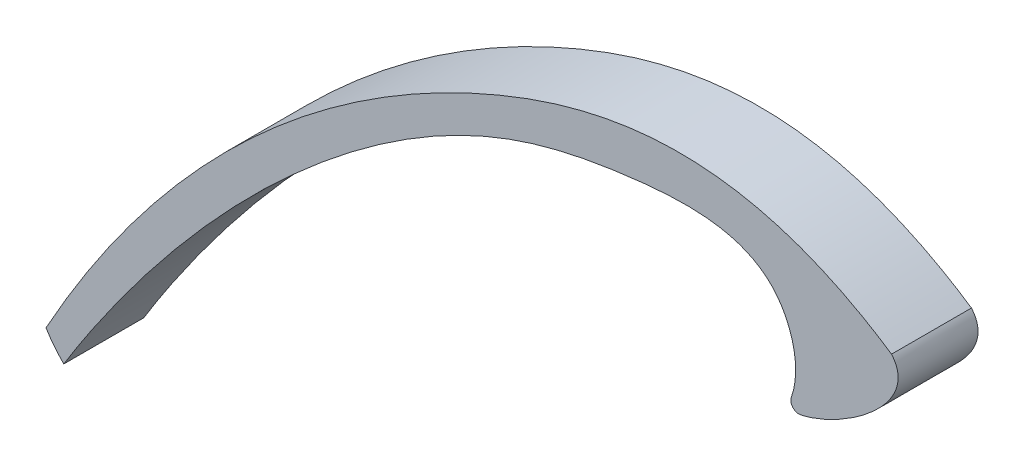
from build123d import *

# Parameters (mm, degrees)
BOSS_EXTRUDE2_DEPTH     = 5
CUT_EXTRUDE1_DEPTH      = 10
CUT_EXTRUDE1_DEPTH_BACK = 10
FILLET1_R               = 1


with BuildPart() as part:
    # Sketch1 → Boss-Extrude2 (new, symmetric)
    with BuildSketch(Plane.XY):
        with BuildLine():
            add(Edge.make_bspline(
                [(-287.625269042, 225.8864515), (-270.189162674, 244.30260865), (-250.405500955, 277.878469404), (-205.45891028, 282.750306441), (-200.229269232, 268.655423214)],
                knots=[0, 0, 0, 0, 0.680162275, 1, 1, 1, 1], degree=3))
            add(Edge.make_bspline(
                [(-200.229269232, 268.655423214), (-196.567908783, 267.949644162), (-184.229279467, 275.176515906), (-186.559670758, 280.462502314), (-187.019986372, 280.997877447)],
                knots=[0.780421407, 0.780421407, 0.780421407, 0.780421407, 1.561841694, 1.657025081, 1.657025081, 1.657025081, 1.657025081], degree=3))
            add(Edge.make_bspline(
                [(-292.817022104, 230.95956863), (-279.371305125, 255.218678458), (-248.405916062, 286.070404634), (-205.470098812, 293.353762035), (-187.019986372, 280.997877447)],
                knots=[0, 0, 0, 0, 0.593504623, 0.97724346, 0.97724346, 0.97724346, 0.97724346], degree=3))
            add(Edge.make_bspline(
                [(-292.817022104, 230.95956863), (-290.926247708, 227.837866768), (-287.625269042, 225.8864515)],
                knots=[0.533622587, 0.533622587, 0.533622587, 1, 1, 1], degree=2))
        make_face()
    extrude(amount=BOSS_EXTRUDE2_DEPTH, both=True)

    # Sketch2 → Cut-Extrude1 (cut, two sides: drawn at the far end of the back side and taken through both)
    with BuildSketch(Plane.XY.offset(5).offset(-CUT_EXTRUDE1_DEPTH_BACK)):
        with BuildLine():
            add(Edge.make_bspline(
                [(-290.590953302, 228.147328954), (-282.162851045, 241.84756263), (-263.967238021, 264.674207252), (-236.817722683, 280.744930994), (-219.239801341, 284.380312268), (-200.481533448, 285.093301358), (-197.997136713, 272.340391732), (-200.229269232, 268.655423214)],
                knots=[0, 0, 0, 0, 0.44455468, 0.627570264, 0.754797123, 0.896888453, 1, 1, 1, 1], degree=3))
            add(Edge.make_bspline(
                [(-200.229269232, 268.655423214), (-170.510432211, 254.072904929), (-317.665595473, 183.556494313), (-290.590953302, 228.147328954)],
                knots=[0, 0, 0, 0, 1, 1, 1, 1], degree=3))
        make_face()
    extrude(amount=CUT_EXTRUDE1_DEPTH + CUT_EXTRUDE1_DEPTH_BACK, mode=Mode.SUBTRACT)

    # Fillet1
    fillet1_edges = [part.edges().sort_by_distance(p)[0] for p in [
        (-200.229269232, 268.655423214, 2.5),
    ]]
    fillet(fillet1_edges, radius=FILLET1_R)


solid = part.part
